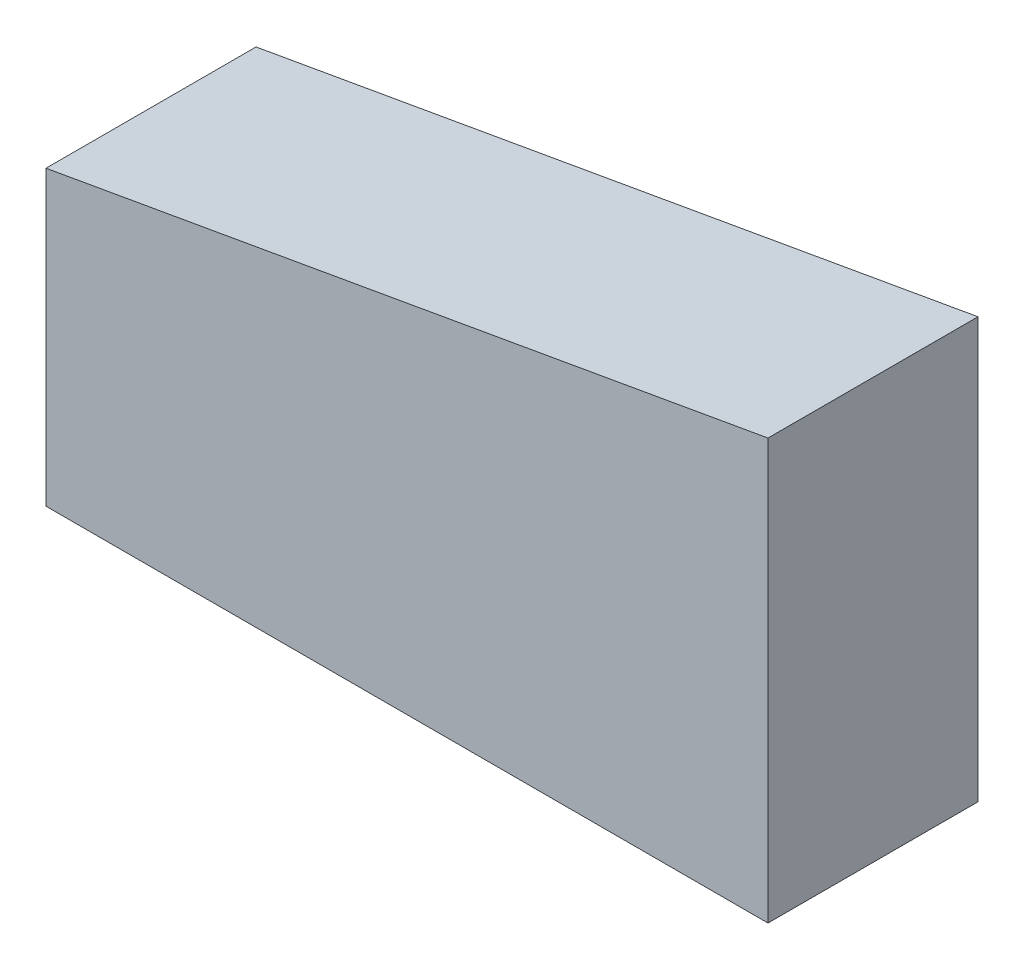
from build123d import *

# Parameters (mm, degrees)
BOSS_EXTRU_1_DEPTH = 8


with BuildPart() as part:
    # Esquisse1 → Boss.-Extru.1 (new, symmetric)
    with BuildSketch(Plane.XY):
        Polygon((-27.5, 0), (27.5, 0), (27.5, 32), (-27.5, 22.302016061), align=None)
    extrude(amount=BOSS_EXTRU_1_DEPTH, both=True)


solid = part.part
